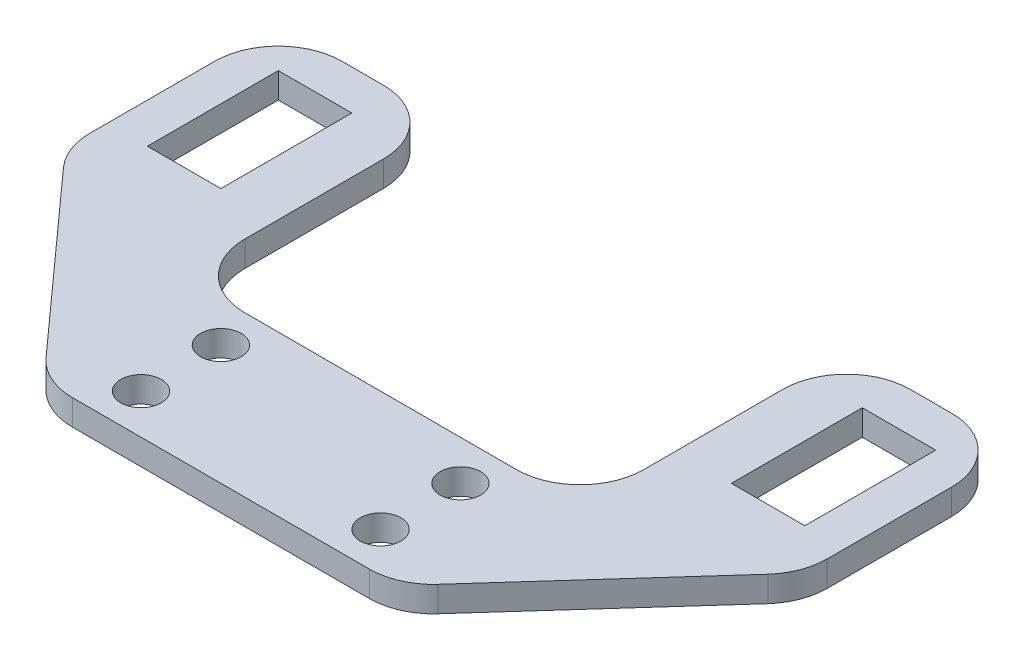
from build123d import *

# Parameters (mm, degrees)
SKETCH1_W           = 58.636614691
SKETCH1_H           = 33.890307345
SKETCH1_R           = 1.6129
SKETCH1_W_2         = 5.842
SKETCH1_H_2         = 10.414
BOSS_EXTRUDE1_DEPTH = 2.032
SKETCH2_W           = 31.75
SKETCH2_H           = 21.190307345
CUT_EXTRUDE1_DEPTH  = 68.756435402
FILLET1_R           = 5.08


with BuildPart() as part:
    # Sketch1 → Boss-Extrude1 (new body)
    with BuildSketch(Plane(origin=(0, 0, 0), x_dir=(1, 0, 0), z_dir=(0, 1, 0))):
        with Locations((29.318307346, 16.945153673)):
            Rectangle(SKETCH1_W, SKETCH1_H)
        with Locations(Location((19.793307345, 9.525, 0), (0, 0, 270))):
            Circle(SKETCH1_R, mode=Mode.SUBTRACT)
        with Locations(Location((19.793307345, 3.175, 0), (0, 0, 270))):
            Circle(SKETCH1_R, mode=Mode.SUBTRACT)
        with Locations(Location((38.843307345, 3.175, 0), (0, 0, 90))):
            Circle(SKETCH1_R, mode=Mode.SUBTRACT)
        with Locations(Location((38.843307345, 9.525, 0), (0, 0, 90))):
            Circle(SKETCH1_R, mode=Mode.SUBTRACT)
        with Locations((6.096, 25.508307345)):
            Rectangle(SKETCH1_W_2, SKETCH1_H_2, mode=Mode.SUBTRACT)
        with Locations((52.540614691, 25.508307345)):
            Rectangle(SKETCH1_W_2, SKETCH1_H_2, mode=Mode.SUBTRACT)
    extrude(amount=BOSS_EXTRUDE1_DEPTH)

    # Sketch2 → Cut-Extrude1 (cut, through all)
    with BuildSketch(Plane(origin=(0, 2.032, 0), x_dir=(1, 0, 0), z_dir=(0, 1, 0))):
        with Locations((29.318307345, 23.295153673)):
            Rectangle(SKETCH2_W, SKETCH2_H)
        Polygon((0, 16.945153673), (15.24, 0), (0, 0), align=None)
        Polygon((43.396614691, 0), (58.636614691, 0), (58.636614691, 16.945153673), align=None)
    extrude(amount=-CUT_EXTRUDE1_DEPTH, mode=Mode.SUBTRACT)

    # Fillet1
    fillet1_edges = [part.edges().sort_by_distance(p)[0] for p in [
        (43.396614691, 1.016, 0),
        (58.636614691, 1.016, -16.945153673),
        (0, 1.016, -16.945153673),
        (15.24, 1.016, 0),
        (0, 1.016, -33.890307345),
        (58.636614691, 1.016, -33.890307345),
        (13.443307345, 1.016, -33.890307345),
        (45.193307345, 1.016, -33.890307345),
        (45.193307345, 1.016, -12.7),
        (13.443307345, 1.016, -12.7),
    ]]
    fillet(fillet1_edges, radius=FILLET1_R)


solid = part.part
